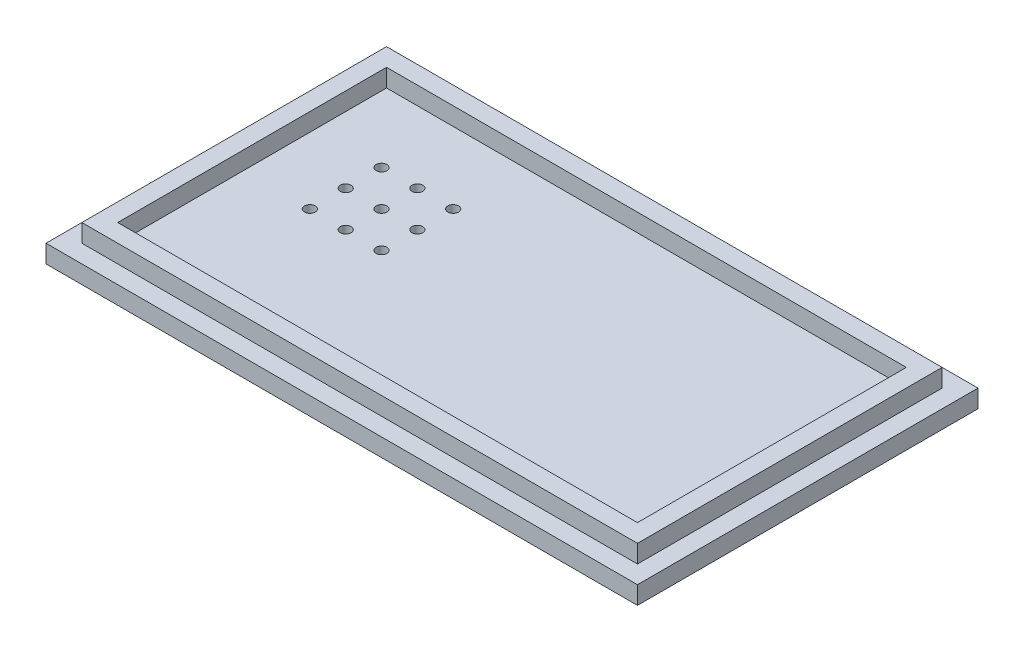
from build123d import *

# Parameters (mm, degrees)
SKETCH1_W           = 165
SKETCH1_H           = 95
BOSS_EXTRUDE1_DEPTH = 5
SKETCH2_W           = 155
SKETCH2_H           = 85
SKETCH2_W_2         = 145
SKETCH2_H_2         = 75
BOSS_EXTRUDE2_DEPTH = 5
SKETCH3_R           = 1.5
CUT_EXTRUDE1_DEPTH  = 5


with BuildPart() as part:
    # Sketch1 → Boss-Extrude1 (new body)
    with BuildSketch(Plane(origin=(0, 0, 0), x_dir=(1, 0, 0), z_dir=(0, 1, 0))):
        Rectangle(SKETCH1_W, SKETCH1_H)
    extrude(amount=BOSS_EXTRUDE1_DEPTH)

    # Sketch2 → Boss-Extrude2 (add)
    with BuildSketch(Plane(origin=(0, 5, 0), x_dir=(1, 0, 0), z_dir=(0, 1, 0))):
        Rectangle(SKETCH2_W, SKETCH2_H)
        Rectangle(SKETCH2_W_2, SKETCH2_H_2, mode=Mode.SUBTRACT)
    extrude(amount=BOSS_EXTRUDE2_DEPTH)

    # Sketch3 → Cut-Extrude1 (cut)
    with BuildSketch(Plane(origin=(0, 5, 0), x_dir=(1, 0, 0), z_dir=(0, 1, 0))):
        with Locations(Location((-53.973401438, 17.572735352, 0), (0, 0, 270))):
            Circle(SKETCH3_R)
        with Locations(Location((-43.973401438, 17.572735352, 0), (0, 0, 270))):
            Circle(SKETCH3_R)
        with Locations(Location((-33.973401438, 17.572735352, 0), (0, 0, 270))):
            Circle(SKETCH3_R)
        with Locations(Location((-43.973401438, 7.572735352, 0), (0, 0, 270))):
            Circle(SKETCH3_R)
        with Locations(Location((-33.973401438, 7.572735352, 0), (0, 0, 270))):
            Circle(SKETCH3_R)
        with Locations(Location((-43.973401438, -2.427264648, 0), (0, 0, 270))):
            Circle(SKETCH3_R)
        with Locations(Location((-33.973401438, -2.427264648, 0), (0, 0, 270))):
            Circle(SKETCH3_R)
        with Locations(Location((-53.973401438, 7.572735352, 0), (0, 0, 270))):
            Circle(SKETCH3_R)
        with Locations(Location((-53.973401438, -2.427264648, 0), (0, 0, 270))):
            Circle(SKETCH3_R)
    extrude(amount=-CUT_EXTRUDE1_DEPTH, mode=Mode.SUBTRACT)


solid = part.part
